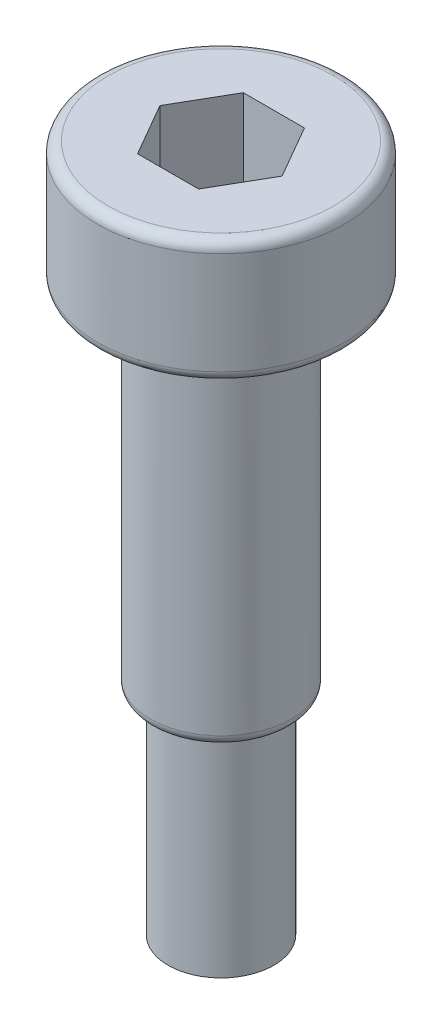
from build123d import *

# Parameters (mm, degrees)
FILLET_1_R          = 0.3
CUT_EXTRUDE_1_DEPTH = 2.4


with BuildPart() as part:
    # 草图1 → 旋转1 (revolve)
    with BuildSketch(Plane.XY):
        Polygon((0, 0), (-1.5, 0), (-1.5, 6), (-2, 6), (-2, 16), (-3.5, 16), (-3.5, 19.5), (0, 19.5), align=None)
    revolve(axis=Axis((0, 19.5, 0), (0, -1, 0)))

    # 圆角1
    fillet_1_edges = [part.edges().sort_by_distance(p)[0] for p in [
        (3.5, 19.5, 0),
        (3.5, 16, 0),
        (2, 6, 0),
    ]]
    fillet(fillet_1_edges, radius=FILLET_1_R)

    # 草图2 → 切除-拉伸1 (cut)
    with BuildSketch(Plane(origin=(0, 19.5, 0), x_dir=(1, 0, 0), z_dir=(0, 1, 0))):
        Polygon((0.866025404, -1.5), (1.732050808, 0), (0.866025404, 1.5), (-0.866025404, 1.5), (-1.732050808, 0), (-0.866025404, -1.5), align=None)
    extrude(amount=-CUT_EXTRUDE_1_DEPTH, mode=Mode.SUBTRACT)


solid = part.part
